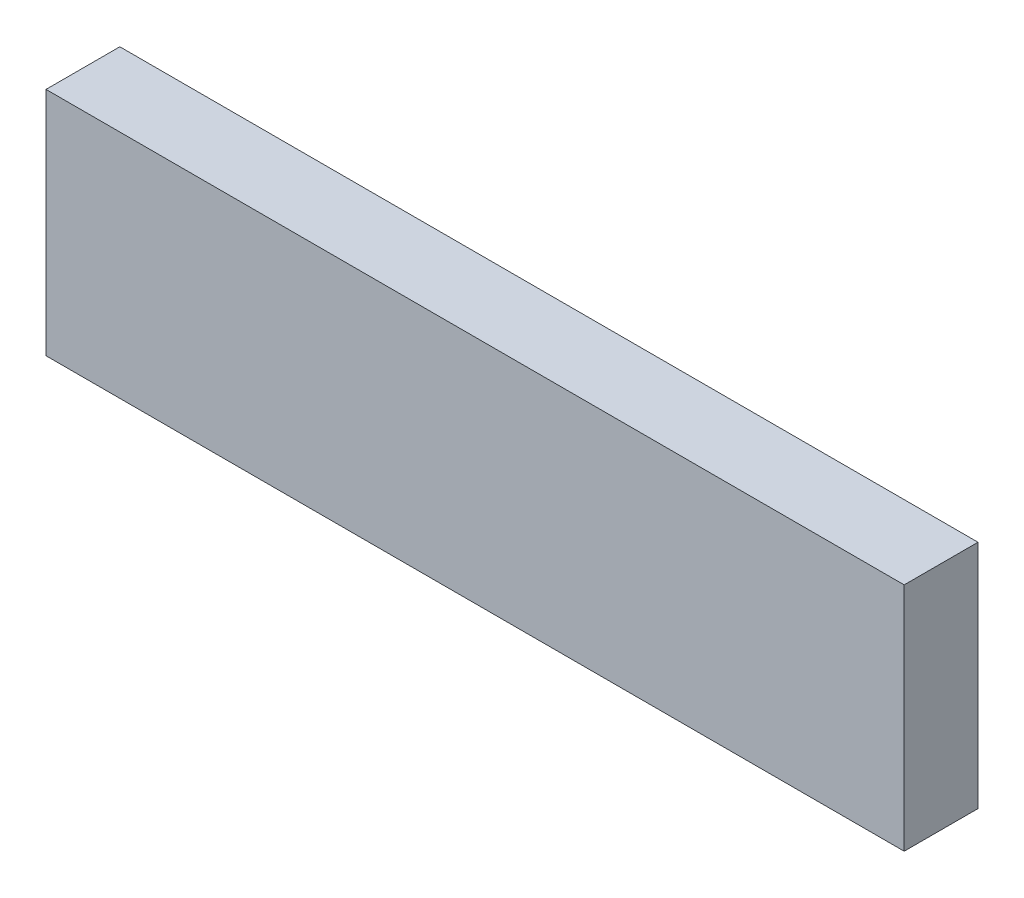
from build123d import *

# Parameters (mm, degrees)
ESBO_O_PESO_W        = 93
ESBO_O_PESO_H        = 25
EXTRUSS_O_PESO_DEPTH = 8


with BuildPart() as part:
    # Esboço_peso → Extrussão_peso (new body)
    with BuildSketch(Plane.XY):
        with Locations((46.5, 12.5)):
            Rectangle(ESBO_O_PESO_W, ESBO_O_PESO_H)
    extrude(amount=EXTRUSS_O_PESO_DEPTH)


solid = part.part
